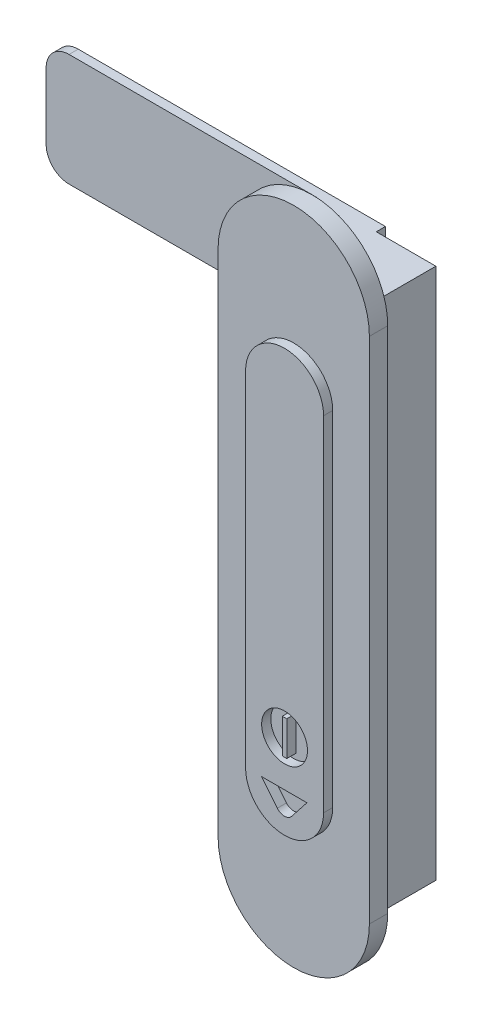
from build123d import *

# Parameters (mm, degrees)
EXTRUDE_1_DEPTH     = 4
SKETCH_2_R          = 5
EXTRUDE_2_DEPTH     = 2
SKETCH_3_W          = 0.972791726
SKETCH_3_H          = 7.511993454
EXTRUDE_3_DEPTH     = 2
CUT_EXTRUDE_1_DEPTH = 2
FILLET_1_R          = 2
SKETCH_5_W          = 26
SKETCH_5_H          = 116
EXTRUDE_4_DEPTH     = 14
EXTRUDE_5_DEPTH     = 2


with BuildPart() as part:
    # 草图1 → 凸台-拉伸1 (new body)
    with BuildSketch(Plane.XY):
        with BuildLine():
            Line((-16.5, -55.5), (-16.5, 55.5))
            ThreePointArc((-16.5, 55.5), (0, 72), (16.5, 55.5))
            Line((16.5, 55.5), (16.5, -55.5))
            ThreePointArc((16.5, -55.5), (0, -72), (-16.5, -55.5))
        make_face()
    extrude(amount=EXTRUDE_1_DEPTH)

    # 草图2 → 凸台-拉伸2 (add)
    with BuildSketch(Plane.XY.offset(4)):
        with BuildLine():
            Line((-8.5, -37.5), (-8.5, 37.5))
            ThreePointArc((-8.5, 37.5), (0, 46), (8.5, 37.5))
            Line((8.5, 37.5), (8.5, -37.5))
            ThreePointArc((8.5, -37.5), (0, -46), (-8.5, -37.5))
        make_face()
        with Locations((0, -27.5)):
            Circle(SKETCH_2_R, mode=Mode.SUBTRACT)
    extrude(amount=EXTRUDE_2_DEPTH)

    # 草图3 → 凸台-拉伸3 (add)
    with BuildSketch(Plane.XY.offset(4)):
        with Locations((0, -27.5)):
            Rectangle(SKETCH_3_W, SKETCH_3_H)
    extrude(amount=EXTRUDE_3_DEPTH)

    # 草图4 → 切除-拉伸1 (cut)
    with BuildSketch(Plane.XY.offset(6)):
        Polygon((0, -43.613819341), (4.879446047, -37.404094744), (-5, -37.404094744), align=None)
    extrude(amount=-CUT_EXTRUDE_1_DEPTH, mode=Mode.SUBTRACT)

    # 圆角1
    fillet_1_edges = [part.edges().sort_by_distance(p)[0] for p in [
        (0, -43.613819341, 5),
    ]]
    fillet(fillet_1_edges, radius=FILLET_1_R)

    # 草图5 → 凸台-拉伸4 (add)
    with BuildSketch(Plane(origin=(0, 0, 0), x_dir=(-1, 0, 0), z_dir=(0, 0, -1))):
        Rectangle(SKETCH_5_W, SKETCH_5_H)
    extrude(amount=EXTRUDE_4_DEPTH)

    # 草图6 → 凸台-拉伸5 (add)
    with BuildSketch(Plane(origin=(0, 0, -14), x_dir=(-1, 0, 0), z_dir=(0, 0, -1))):
        with BuildLine():
            Line((0, 58), (67, 58))
            ThreePointArc((67, 58), (70.535533906, 56.535533906), (72, 53))
            Line((72, 53), (72, 38.5))
            ThreePointArc((72, 38.5), (70.535533906, 34.964466094), (67, 33.5))
            Line((67, 33.5), (0, 33.5))
            Line((0, 33.5), (0, 58))
        make_face()
    extrude(amount=EXTRUDE_5_DEPTH)


solid = part.part
